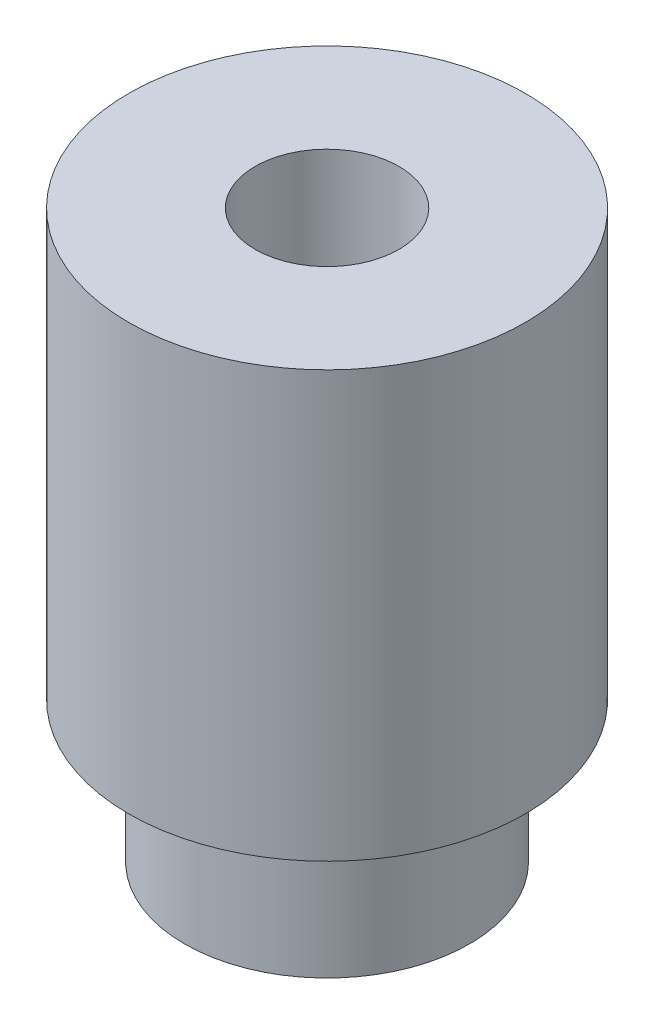
from build123d import *

# Parameters (mm, degrees)
SKETCH1_R           = 10.033
BOSS_EXTRUDE1_DEPTH = 9.906
SKETCH2_R           = 13.97
BOSS_EXTRUDE2_DEPTH = 29.972
SKETCH3_R           = 5.0673
CUT_EXTRUDE1_DEPTH  = 45.503670455


with BuildPart() as part:
    # Sketch1 → Boss-Extrude1 (new body)
    with BuildSketch(Plane(origin=(0, 0, 0), x_dir=(1, 0, 0), z_dir=(0, 1, 0))):
        with Locations(Location((0, 0, 0), (0, 0, 270))):
            Circle(SKETCH1_R)
    extrude(amount=BOSS_EXTRUDE1_DEPTH)

    # Sketch2 → Boss-Extrude2 (add)
    with BuildSketch(Plane(origin=(0, 9.906, 0), x_dir=(1, 0, 0), z_dir=(0, 1, 0))):
        with Locations(Location((0, 0, 0), (0, 0, 270))):
            Circle(SKETCH2_R)
    extrude(amount=BOSS_EXTRUDE2_DEPTH)

    # Sketch3 → Cut-Extrude1 (cut, through all)
    with BuildSketch(Plane(origin=(0, 39.878, 0), x_dir=(1, 0, 0), z_dir=(0, 1, 0))):
        with Locations(Location((0, 0, 0), (0, 0, 270))):
            Circle(SKETCH3_R)
    extrude(amount=-CUT_EXTRUDE1_DEPTH, mode=Mode.SUBTRACT)


solid = part.part
